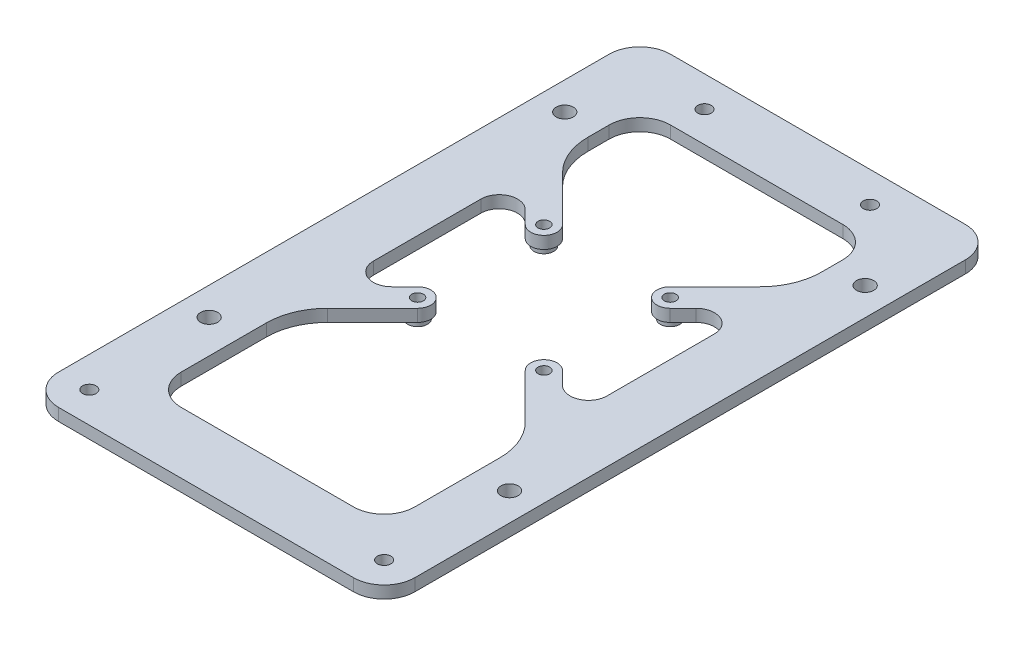
from build123d import *
from build123d.topology import SkipClean

# Parameters (mm, degrees)
SKETCH3_W           = 58.1
SKETCH3_H           = 99.8
SKETCH3_R           = 1.1
SKETCH3_R_2         = 0.95
SKETCH3_R_3         = 1.4
BOSS_EXTRUDE1_DEPTH = 2
FILLET1_R           = 5
FILLET2_R           = 3
FILLET3_R           = 10
BOSS_EXTRUDE2_START = 1
SKETCH4_R           = 1.6
SKETCH4_R_2         = 0.95
BOSS_EXTRUDE2_DEPTH = 1


with BuildPart() as part:
    # Sketch3 → Boss-Extrude1 (new body)
    with BuildSketch(Plane(origin=(0, 0, 0), x_dir=(1, 0, 0), z_dir=(0, 1, 0))):
        with Locations((0, -5.2)):
            Rectangle(SKETCH3_W, SKETCH3_H)
        with Locations(Location((24.05, -50.1, 0), (0, 0, 270))):
            Circle(SKETCH3_R, mode=Mode.SUBTRACT)
        with Locations(Location((-10.3, -10.3, 0), (0, 0, 270))):
            Circle(SKETCH3_R_2, mode=Mode.SUBTRACT)
        with Locations(Location((13.5, 39.7, 0), (0, 0, 270))):
            Circle(SKETCH3_R, mode=Mode.SUBTRACT)
        with Locations(Location((-13.5, 39.7, 0), (0, 0, 270))):
            Circle(SKETCH3_R, mode=Mode.SUBTRACT)
        with Locations(Location((-24.05, -50.1, 0), (0, 0, 270))):
            Circle(SKETCH3_R, mode=Mode.SUBTRACT)
        with Locations(Location((-24.5, 27.9, 0), (0, 0, 270))):
            Circle(SKETCH3_R_3, mode=Mode.SUBTRACT)
        with Locations(Location((24.5, 27.9, 0), (0, 0, 270))):
            Circle(SKETCH3_R_3, mode=Mode.SUBTRACT)
        with Locations(Location((10.3, 10.3, 0), (0, 0, 270))):
            Circle(SKETCH3_R_2, mode=Mode.SUBTRACT)
        with Locations(Location((10.3, -10.3, 0), (0, 0, 270))):
            Circle(SKETCH3_R_2, mode=Mode.SUBTRACT)
        with Locations(Location((-10.3, 10.3, 0), (0, 0, 270))):
            Circle(SKETCH3_R_2, mode=Mode.SUBTRACT)
        with Locations(Location((-24.5, -30.1, 0), (0, 0, 270))):
            Circle(SKETCH3_R_3, mode=Mode.SUBTRACT)
        with Locations(Location((24.5, -30.1, 0), (0, 0, 270))):
            Circle(SKETCH3_R_3, mode=Mode.SUBTRACT)
        with BuildLine():
            Line((19.05, -45.1), (19.05, -22.090559159))
            Line((19.05, -22.090559159), (8.77972042, -11.82027958))
            ThreePointArc((8.77972042, -11.82027958), (8.77972042, -8.77972042), (11.82027958, -8.77972042))
            Line((11.82027958, -8.77972042), (19.05, -16.009440841))
            Line((19.05, -16.009440841), (19.05, 16.009440841))
            Line((19.05, 16.009440841), (11.82027958, 8.77972042))
            ThreePointArc((11.82027958, 8.77972042), (8.77972042, 8.77972042), (8.77972042, 11.82027958))
            Line((8.77972042, 11.82027958), (19.05, 22.090559159))
            Line((19.05, 22.090559159), (19.05, 34.7))
            Line((19.05, 34.7), (-19.05, 34.7))
            Line((-19.05, 34.7), (-19.05, 22.090559159))
            Line((-19.05, 22.090559159), (-8.77972042, 11.82027958))
            ThreePointArc((-8.77972042, 11.82027958), (-8.77972042, 8.77972042), (-11.82027958, 8.77972042))
            Line((-11.82027958, 8.77972042), (-19.05, 16.009440841))
            Line((-19.05, 16.009440841), (-19.05, -16.009440841))
            Line((-19.05, -16.009440841), (-11.82027958, -8.77972042))
            ThreePointArc((-11.82027958, -8.77972042), (-8.77972042, -8.77972042), (-8.77972042, -11.82027958))
            Line((-8.77972042, -11.82027958), (-19.05, -22.090559159))
            Line((-19.05, -22.090559159), (-19.05, -45.1))
            Line((-19.05, -45.1), (19.05, -45.1))
        make_face(mode=Mode.SUBTRACT)
    extrude(amount=BOSS_EXTRUDE1_DEPTH)

    # Fillet1
    fillet1_edges = [part.edges().sort_by_distance(p)[0] for p in [
        (19.05, 1, -34.7),
        (-19.05, 1, -34.7),
        (-19.05, 1, 45.1),
        (19.05, 1, 45.1),
        (29.05, 1, -44.7),
        (29.05, 1, 55.1),
        (-29.05, 1, 55.1),
        (-29.05, 1, -44.7),
    ]]
    fillet(fillet1_edges, radius=FILLET1_R)

    # Fillet2
    fillet2_edges = [part.edges().sort_by_distance(p)[0] for p in [
        (-19.05, 1, -16.009440841),
        (-19.05, 1, 16.009440841),
        (19.05, 1, 16.009440841),
        (19.05, 1, -16.009440841),
    ]]
    fillet(fillet2_edges, radius=FILLET2_R)

    # Fillet3
    fillet3_edges = [part.edges().sort_by_distance(p)[0] for p in [
        (19.05, 1, -22.090559159),
        (-19.05, 1, -22.090559159),
        (-19.05, 1, 22.090559159),
        (19.05, 1, 22.090559159),
    ]]
    fillet(fillet3_edges, radius=FILLET3_R)

    # Sketch4 → Boss-Extrude2 (add)
    # profile 1 of 4: a face of its own
    with SkipClean():  # the faces are left unmerged after this step: merging them gives an invalid solid
        with BuildSketch(Plane.XZ.offset(BOSS_EXTRUDE2_START)):
            with Locations(Location((-10.3, 10.3, 0), (0, 0, 90))):
                Circle(SKETCH4_R)
            with Locations(Location((-10.3, 10.3, 0), (0, 0, 270))):
                Circle(SKETCH4_R_2, mode=Mode.SUBTRACT)
        # profile 2 of 4: a face of its own
        with BuildSketch(Plane.XZ.offset(BOSS_EXTRUDE2_START)):
            with Locations(Location((10.3, 10.3, 0), (0, 0, 90))):
                Circle(SKETCH4_R)
            with Locations(Location((10.3, 10.3, 0), (0, 0, 270))):
                Circle(SKETCH4_R_2, mode=Mode.SUBTRACT)
        # profile 3 of 4: a face of its own
        with BuildSketch(Plane.XZ.offset(BOSS_EXTRUDE2_START)):
            with Locations(Location((10.3, -10.3, 0), (0, 0, 90))):
                Circle(SKETCH4_R)
            with Locations(Location((10.3, -10.3, 0), (0, 0, 270))):
                Circle(SKETCH4_R_2, mode=Mode.SUBTRACT)
        # profile 4 of 4: a face of its own
        with BuildSketch(Plane.XZ.offset(BOSS_EXTRUDE2_START)):
            with Locations(Location((-10.3, -10.3, 0), (0, 0, 90))):
                Circle(SKETCH4_R)
            with Locations(Location((-10.3, -10.3, 0), (0, 0, 270))):
                Circle(SKETCH4_R_2, mode=Mode.SUBTRACT)
        extrude(amount=-BOSS_EXTRUDE2_DEPTH)


solid = part.part
